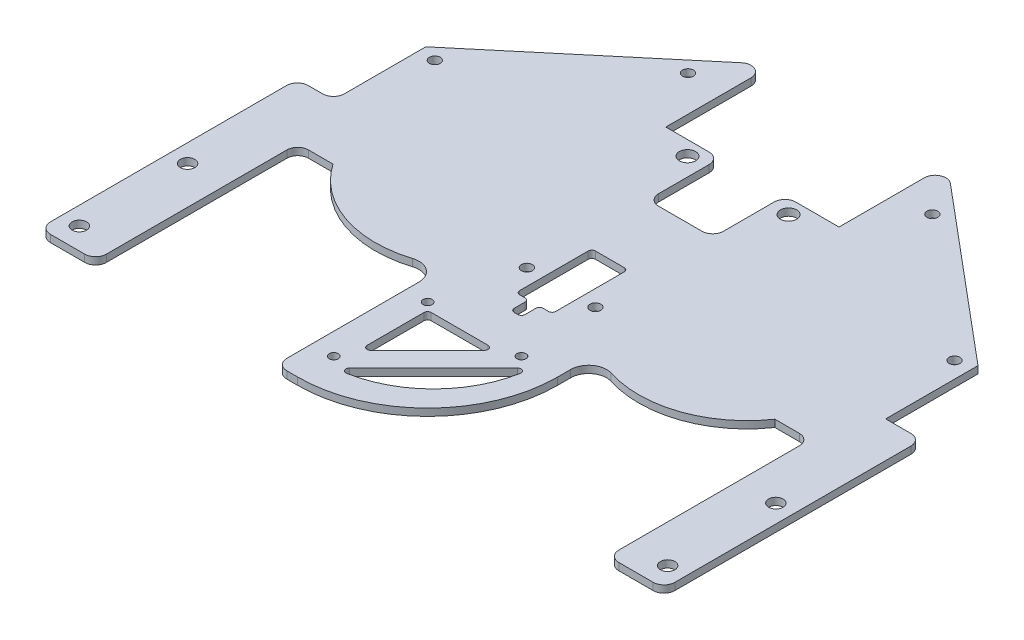
from build123d import *

# Parameters (mm, degrees)
SKETCH_1_W           = 153
SKETCH_1_H           = 97
EXTRUDE_1_DEPTH      = 2
SKETCH_2_W           = 30
SKETCH_2_H           = 56
EXTRUDE_2_DEPTH      = 2
EXTRUDE_3_DEPTH      = 2
SKETCH_4_W           = 10
SKETCH_4_H           = 42
SKETCH_4_R           = 2
EXTRUDE_4_DEPTH      = 2
SKETCH_6_R           = 2.25
CUT_EXTRUDE_1_DEPTH  = 2
SKETCH_7_W           = 50
SKETCH_7_H           = 56
CUT_EXTRUDE_2_DEPTH  = 2
SKETCH_8_W           = 48
SKETCH_8_H           = 62.484205033
CUT_EXTRUDE_3_DEPTH  = 2
FILLET_3_R           = 3
SKETCH_9_W           = 10
SKETCH_9_H           = 29.42018392
EXTRUDE_5_DEPTH      = 2
FILLET_4_R           = 3
SKETCH_10_W          = 18
SKETCH_10_H          = 20
CUT_EXTRUDE_4_DEPTH  = 2
FILLET_5_R           = 3
SKETCH_11_R          = 30
EXTRUDE_6_DEPTH      = 2
FILLET_6_R           = 3
SKETCH_12_R          = 1.25
CUT_EXTRUDE_5_DEPTH  = 2
SKETCH_13_R          = 1.5
CUT_EXTRUDE_6_DEPTH  = 10
SKETCH_14_R          = 1.5
CUT_EXTRUDE_7_DEPTH  = 10
CUT_EXTRUDE_8_DEPTH  = 10
FILLET_7_R           = 5
SKETCH_16_R          = 1.5
CUT_EXTRUDE_9_DEPTH  = 10
SKETCH_17_W          = 10
SKETCH_17_H          = 21
CUT_EXTRUDE_10_DEPTH = 10
FILLET_8_R           = 1
SKETCH_18_W          = 3
SKETCH_18_H          = 5
CUT_EXTRUDE_11_DEPTH = 10
FILLET_9_R           = 1
CUT_EXTRUDE_12_DEPTH = 2
FILLET_10_R          = 1
CUT_EXTRUDE_13_DEPTH = 2
FILLET_11_R          = 1


with BuildPart() as part:
    # 草图1 → 凸台-拉伸1 (new body)
    with BuildSketch(Plane(origin=(0, 0, 0), x_dir=(1, 0, 0), z_dir=(0, 1, 0))):
        Rectangle(SKETCH_1_W, SKETCH_1_H)
    extrude(amount=EXTRUDE_1_DEPTH)

    # 草图2 → 凸台-拉伸2 (add)
    with BuildSketch(Plane(origin=(0, 0, 0), x_dir=(1, 0, 0), z_dir=(0, 1, 0))):
        with Locations((0, 76.5)):
            Rectangle(SKETCH_2_W, SKETCH_2_H)
    extrude(amount=EXTRUDE_2_DEPTH)

    # 草图3 → 凸台-拉伸3 (add)
    with BuildSketch(Plane(origin=(0, 2, 0), x_dir=(1, 0, 0), z_dir=(0, 1, 0))):
        Polygon((-76.5, 48.5), (-15, 100.1), (-15, 48.5), align=None)
        Polygon((15, 100.1), (15, 48.5), (76.5, 48.5), align=None)
    extrude(amount=-EXTRUDE_3_DEPTH)

    # 草图4 → 凸台-拉伸4 (add)
    # profile 1 of 2: a face of its own
    with BuildSketch(Plane(origin=(0, 2, 0), x_dir=(1, 0, 0), z_dir=(0, 1, 0))):
        with Locations((-81.5, -27.5)):
            Rectangle(SKETCH_4_W, SKETCH_4_H)
        with Locations(Location((-81.5, -12.5, 0), (0, 0, 270))):
            Circle(SKETCH_4_R, mode=Mode.SUBTRACT)
        with Locations(Location((-81.5, -42.5, 0), (0, 0, 90))):
            Circle(SKETCH_4_R, mode=Mode.SUBTRACT)
    # profile 2 of 2: a face of its own
    with BuildSketch(Plane(origin=(0, 2, 0), x_dir=(1, 0, 0), z_dir=(0, 1, 0))):
        with Locations((81.5, -27.5)):
            Rectangle(SKETCH_4_W, SKETCH_4_H)
        with Locations(Location((81.5, -42.5, 0), (0, 0, 270))):
            Circle(SKETCH_4_R, mode=Mode.SUBTRACT)
        with Locations(Location((81.5, -12.5, 0), (0, 0, 90))):
            Circle(SKETCH_4_R, mode=Mode.SUBTRACT)
    extrude(amount=-EXTRUDE_4_DEPTH)

    # 草图6 → 切除-拉伸1 (cut)
    with BuildSketch(Plane(origin=(0, 2, 0), x_dir=(1, 0, 0), z_dir=(0, 1, 0))):
        with Locations(Location((14, 58.5, 0), (0, 0, 270))):
            Circle(SKETCH_6_R)
        with Locations(Location((-14, 58.5, 0), (0, 0, 90))):
            Circle(SKETCH_6_R)
    extrude(amount=-CUT_EXTRUDE_1_DEPTH, mode=Mode.SUBTRACT)

    # 草图7 → 切除-拉伸2 (cut)
    with BuildSketch(Plane(origin=(0, 2, 0), x_dir=(1, 0, 0), z_dir=(0, 1, 0))):
        with Locations((-46, -20.5)):
            Rectangle(SKETCH_7_W, SKETCH_7_H)
        with Locations((46, -20.5)):
            Rectangle(SKETCH_7_W, SKETCH_7_H)
    extrude(amount=-CUT_EXTRUDE_2_DEPTH, mode=Mode.SUBTRACT)

    # 草图8 → 切除-拉伸3 (cut)
    with BuildSketch(Plane(origin=(0, 2, 0), x_dir=(1, 0, 0), z_dir=(0, 1, 0))):
        with Locations((0, 93.742102517)):
            Rectangle(SKETCH_8_W, SKETCH_8_H)
    extrude(amount=-CUT_EXTRUDE_3_DEPTH, mode=Mode.SUBTRACT)

    # 圆角3
    fillet_3_edges = [part.edges().sort_by_distance(p)[0] for p in [
        (-21, 1, -7.5),
        (-21, 1, 48.5),
        (-71, 1, 48.5),
        (-71, 1, -7.5),
        (21, 1, -7.5),
        (71, 1, -7.5),
        (71, 1, 48.5),
        (21, 1, 48.5),
    ]]
    fillet(fillet_3_edges, radius=FILLET_3_R)

    # 草图9 → 凸台-拉伸5 (add)
    with BuildSketch(Plane(origin=(0, 2, 0), x_dir=(1, 0, 0), z_dir=(0, 1, 0))):
        with Locations((-81.5, 8.21009196)):
            Rectangle(SKETCH_9_W, SKETCH_9_H)
        with Locations((81.5, 8.21009196)):
            Rectangle(SKETCH_9_W, SKETCH_9_H)
    extrude(amount=-EXTRUDE_5_DEPTH)

    # 圆角4
    fillet_4_edges = [part.edges().sort_by_distance(p)[0] for p in [
        (-86.5, 1, -22.92018392),
        (-76.5, 1, -22.92018392),
    ]]
    fillet(fillet_4_edges, radius=FILLET_4_R)

    # 草图10 → 切除-拉伸4 (cut)
    with BuildSketch(Plane(origin=(0, 2, 0), x_dir=(1, 0, 0), z_dir=(0, 1, 0))):
        with Locations((0, 52.5)):
            Rectangle(SKETCH_10_W, SKETCH_10_H)
    extrude(amount=-CUT_EXTRUDE_4_DEPTH, mode=Mode.SUBTRACT)

    # 圆角5
    fillet_5_edges = [part.edges().sort_by_distance(p)[0] for p in [
        (24, 1, -92.548780488),
        (-24, 1, -92.548780488),
        (9, 1, -62.5),
        (9, 1, -42.5),
        (-9, 1, -42.5),
        (-9, 1, -62.5),
    ]]
    fillet(fillet_5_edges, radius=FILLET_5_R)

    # 草图11 → 凸台-拉伸6 (add)
    with BuildSketch(Plane(origin=(0, 2, 0), x_dir=(1, 0, 0), z_dir=(0, 1, 0))):
        with Locations((-36.5, 24.5)):
            Circle(SKETCH_11_R)
        with Locations((36.5, 24.5)):
            Circle(SKETCH_11_R)
    extrude(amount=-EXTRUDE_6_DEPTH)

    # 圆角6
    fillet_6_edges = [part.edges().sort_by_distance(p)[0] for p in [
        (86.5, 1, -22.92018392),
        (-86.5, 1, 48.5),
        (86.5, 1, 48.5),
    ]]
    fillet(fillet_6_edges, radius=FILLET_6_R)

    # 草图12 → 切除-拉伸5 (cut)
    with BuildSketch(Plane(origin=(0, 2, 0), x_dir=(1, 0, 0), z_dir=(0, 1, 0))):
        with Locations(Location((11, -12.5, 0), (0, 0, 270))):
            Circle(SKETCH_12_R)
        with Locations(Location((-15, -12.5, 0), (0, 0, 90))):
            Circle(SKETCH_12_R)
        with Locations(Location((-15, -38.5, 0), (0, 0, 270))):
            Circle(SKETCH_12_R)
    extrude(amount=-CUT_EXTRUDE_5_DEPTH, mode=Mode.SUBTRACT)

    # 草图13 → 切除-拉伸6 (cut)
    with BuildSketch(Plane(origin=(0, 2, 0), x_dir=(1, 0, 0), z_dir=(0, 1, 0))):
        with Locations(Location((-72, 46.5, 0), (0, 0, 270))):
            Circle(SKETCH_13_R)
        with Locations(Location((72, 46.5, 0), (0, 0, 270))):
            Circle(SKETCH_13_R)
    extrude(amount=-CUT_EXTRUDE_6_DEPTH, mode=Mode.SUBTRACT)

    # 草图14 → 切除-拉伸7 (cut)
    with BuildSketch(Plane(origin=(0, 2, 0), x_dir=(1, 0, 0), z_dir=(0, 1, 0))):
        with Locations(Location((-33.860465116, 78.5, 0), (0, 0, 270))):
            Circle(SKETCH_14_R)
        with Locations(Location((33.860465116, 78.5, 0), (0, 0, 270))):
            Circle(SKETCH_14_R)
    extrude(amount=-CUT_EXTRUDE_7_DEPTH, mode=Mode.SUBTRACT)

    # 草图15 → 切除-拉伸8 (cut)
    with BuildSketch(Plane(origin=(0, 2, 0), x_dir=(1, 0, 0), z_dir=(0, 1, 0))):
        with BuildLine():
            Line((21, -12.5), (21, -48.5))
            Line((21, -48.5), (-15, -48.5))
            ThreePointArc((-15, -48.5), (10.455844123, -37.955844123), (21, -12.5))
        make_face()
    extrude(amount=-CUT_EXTRUDE_8_DEPTH, mode=Mode.SUBTRACT)

    # 圆角7
    fillet_7_edges = [part.edges().sort_by_distance(p)[0] for p in [
        (-21, 1, 1.185599078),
        (21, 1, 1.185599078),
    ]]
    fillet(fillet_7_edges, radius=FILLET_7_R)

    # 草图16 → 切除-拉伸9 (cut)
    with BuildSketch(Plane(origin=(0, 2, 0), x_dir=(1, 0, 0), z_dir=(0, 1, 0))):
        with Locations(Location((9.5, 9.5, 0), (0, 0, 270))):
            Circle(SKETCH_16_R)
        with Locations(Location((-9.5, 9.5, 0), (0, 0, 270))):
            Circle(SKETCH_16_R)
    extrude(amount=-CUT_EXTRUDE_9_DEPTH, mode=Mode.SUBTRACT)

    # 草图17 → 切除-拉伸10 (cut)
    with BuildSketch(Plane(origin=(0, 2, 0), x_dir=(1, 0, 0), z_dir=(0, 1, 0))):
        with Locations((0, 12.5)):
            Rectangle(SKETCH_17_W, SKETCH_17_H)
    extrude(amount=-CUT_EXTRUDE_10_DEPTH, mode=Mode.SUBTRACT)

    # 圆角8
    fillet_8_edges = [part.edges().sort_by_distance(p)[0] for p in [
        (5, 1, -23),
        (5, 1, -2),
        (-5, 1, -2),
        (-5, 1, -23),
    ]]
    fillet(fillet_8_edges, radius=FILLET_8_R)

    # 草图18 → 切除-拉伸11 (cut)
    with BuildSketch(Plane(origin=(0, 2, 0), x_dir=(1, 0, 0), z_dir=(0, 1, 0))):
        with Locations((0, -0.5)):
            Rectangle(SKETCH_18_W, SKETCH_18_H)
    extrude(amount=-CUT_EXTRUDE_11_DEPTH, mode=Mode.SUBTRACT)

    # 圆角9
    fillet_9_edges = [part.edges().sort_by_distance(p)[0] for p in [
        (-1.5, 1, -2),
        (1.5, 1, -2),
        (1.5, 1, 3),
        (-1.5, 1, 3),
    ]]
    fillet(fillet_9_edges, radius=FILLET_9_R)

    # 草图19 → 切除-拉伸12 (cut)
    with BuildSketch(Plane(origin=(0, 2, 0), x_dir=(1, 0, 0), z_dir=(0, 1, 0))):
        Polygon((-13, -14.5), (-13, -33.671572875), (6.171572875, -14.5), align=None)
    extrude(amount=-CUT_EXTRUDE_12_DEPTH, mode=Mode.SUBTRACT)

    # 圆角10
    fillet_10_edges = [part.edges().sort_by_distance(p)[0] for p in [
        (-13, 1, 14.5),
        (6.171572875, 1, 14.5),
        (-13, 1, 33.671572875),
    ]]
    fillet(fillet_10_edges, radius=FILLET_10_R)

    # 草图21 → 切除-拉伸13 (cut)
    with BuildSketch(Plane(origin=(0, 2, 0), x_dir=(1, 0, 0), z_dir=(0, 1, 0))):
        with BuildLine():
            Line((15.354785216, -13.802069033), (-12.077894802, -41.234749051))
            ThreePointArc((-12.077894802, -41.234749051), (6.669497464, -32.549461299), (15.354785216, -13.802069033))
        make_face()
    extrude(amount=-CUT_EXTRUDE_13_DEPTH, mode=Mode.SUBTRACT)

    # 圆角11
    fillet_11_edges = [part.edges().sort_by_distance(p)[0] for p in [
        (15.354785216, 1, 13.802069033),
        (-12.077894802, 1, 41.234749051),
    ]]
    fillet(fillet_11_edges, radius=FILLET_11_R)


solid = part.part
